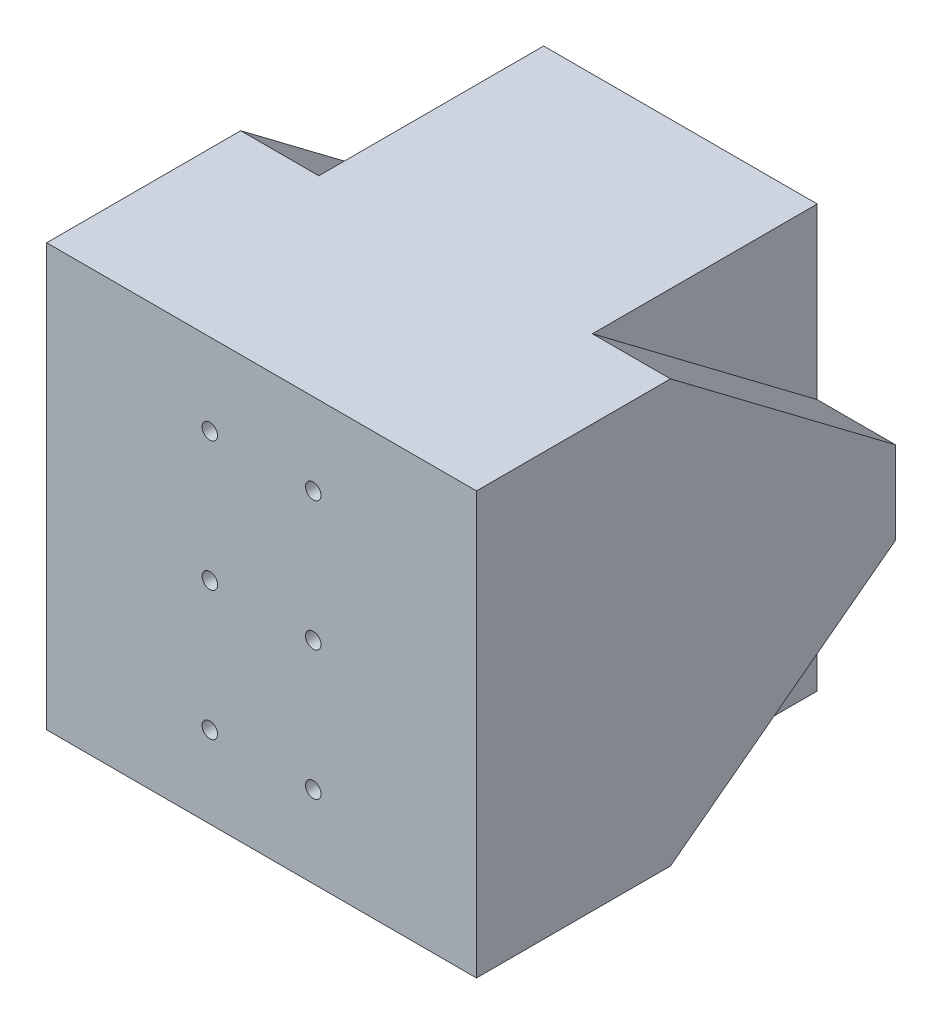
from build123d import *

# Parameters (mm, degrees)
SKETCH_1_W          = 52.9
SKETCH_1_H          = 81.56
EXTRUDE_1_DEPTH     = 80.99
SKETCH_2_W          = 32.9
SKETCH_2_H          = 61.56
CUT_EXTRUDE_1_DEPTH = 75.99
EXTRUDE_2_DEPTH     = 15.1
SKETCH_4_R          = 1.5
CUT_EXTRUDE_2_DEPTH = 100.743626363


with BuildPart() as part:
    # 草图1 → 凸台-拉伸1 (new body)
    with BuildSketch(Plane.XY):
        Rectangle(SKETCH_1_W, SKETCH_1_H)
    extrude(amount=EXTRUDE_1_DEPTH)

    # 草图2 → 切除-拉伸1 (cut)
    with BuildSketch(Plane(origin=(0, 0, 0), x_dir=(-1, 0, 0), z_dir=(0, 0, -1))):
        Rectangle(SKETCH_2_W, SKETCH_2_H)
    extrude(amount=-CUT_EXTRUDE_1_DEPTH, mode=Mode.SUBTRACT)

    # 草图3 → 凸台-拉伸2 (add)
    with BuildSketch(Plane.ZY.offset(26.45)):
        Polygon((80.99, 40.78), (43.47, 40.78), (0, 8.02), (0, -8.02), (43.47, -40.78), (80.99, -40.78), align=None)
    extrude_2 = extrude(amount=EXTRUDE_2_DEPTH)

    # 镜向1: 凸台-拉伸2 across plane
    add(extrude_2.mirror(Plane(origin=(0, 0, 0), x_dir=(0, 0, 1), z_dir=(1, 0, 0))))

    # 草图4 → 切除-拉伸2 (cut, through all)
    with BuildSketch(Plane.XY.offset(80.99)):
        with Locations((-10, 25)):
            Circle(SKETCH_4_R)
        with Locations((10, 25)):
            Circle(SKETCH_4_R)
        with Locations((-10, -25)):
            Circle(SKETCH_4_R)
        with Locations((10, -25)):
            Circle(SKETCH_4_R)
        with Locations((-10, 0)):
            Circle(SKETCH_4_R)
        with Locations((10, 0)):
            Circle(SKETCH_4_R)
    extrude(amount=-CUT_EXTRUDE_2_DEPTH, mode=Mode.SUBTRACT)


solid = part.part
